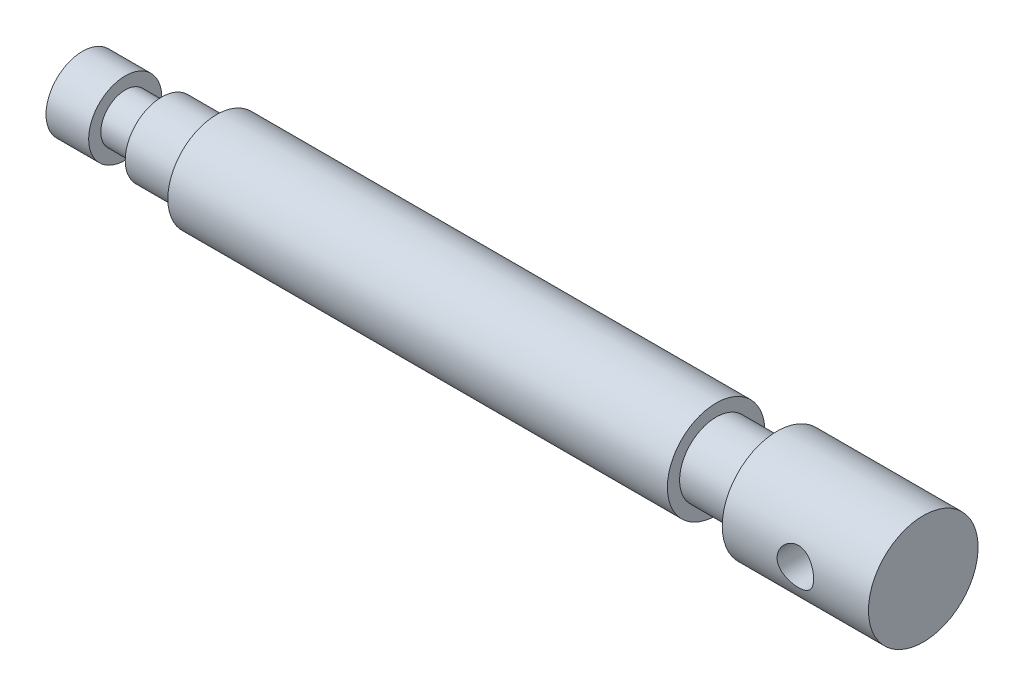
from build123d import *

# Parameters (mm, degrees)
CUT_EXTRUDE1_DEPTH      = 139.585713549
CUT_EXTRUDE1_DEPTH_BACK = 139.585713549
SKETCH2_3_R             = 3


with BuildPart() as part:
    # Sketch2 → Revolve1 (revolve)
    with BuildSketch(Plane.XY):
        with BuildLine():
            ThreePointArc((123, 0), (126, 3), (129, 0))
            Line((129, 0), (138, 0))
            Line((138, 0), (138, 9))
            Line((138, 9), (114, 9))
            Line((114, 9), (114, 6))
            Line((114, 6), (104, 6))
            Line((104, 6), (104, 8))
            Line((104, 8), (22, 8))
            Line((22, 8), (22, 6))
            Line((22, 6), (13, 6))
            Line((13, 6), (13, 4))
            Line((13, 4), (7, 4))
            Line((7, 4), (7, 6))
            Line((7, 6), (0, 6))
            Line((0, 6), (0, 0))
            Line((0, 0), (123, 0))
        make_face()
    revolve(axis=Axis((0, 0, 0), (1, 0, 0)))

    # Sketch2<3> → Cut-Extrude1 (cut, two sides: drawn at the far end of the back side and taken through both)
    with BuildSketch(Plane.XY.offset(-CUT_EXTRUDE1_DEPTH_BACK)):
        with Locations((126, 0)):
            Circle(SKETCH2_3_R)
    extrude(amount=CUT_EXTRUDE1_DEPTH + CUT_EXTRUDE1_DEPTH_BACK, mode=Mode.SUBTRACT)


solid = part.part
